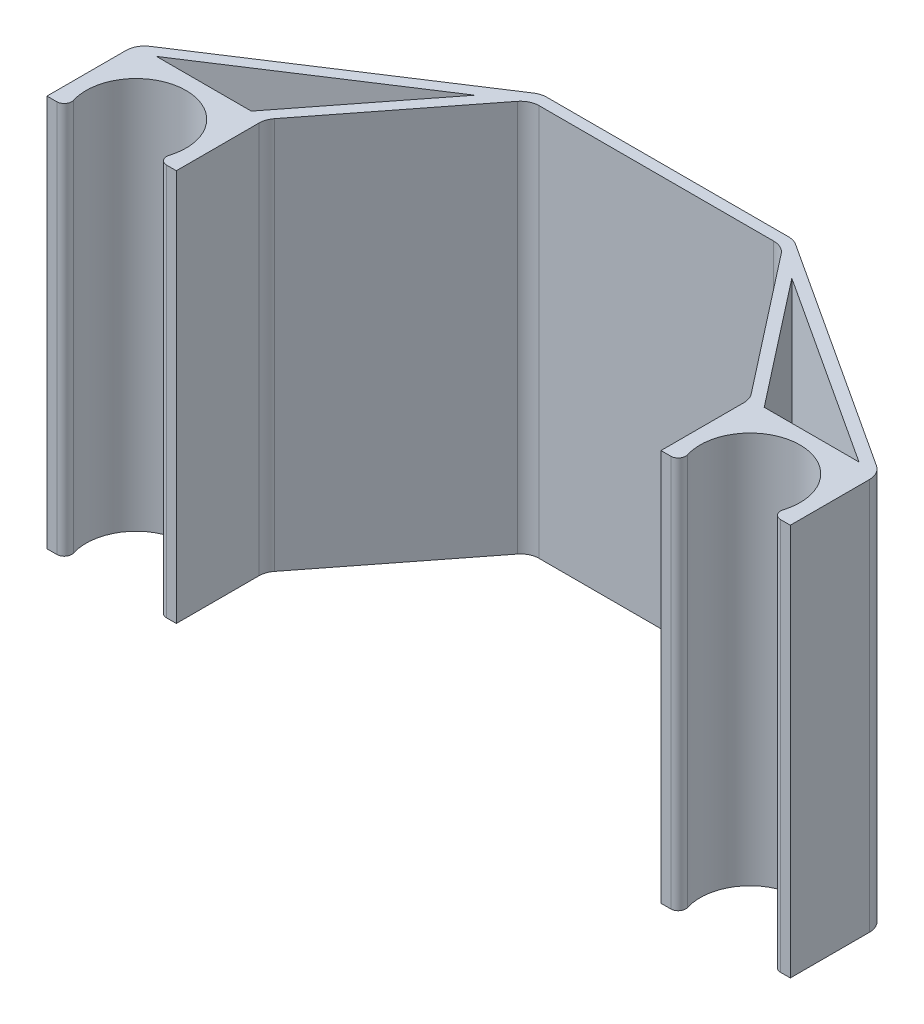
from build123d import *

# Parameters (mm, degrees)
BOSS_EXTRUDE1_DEPTH = 105.5
FILLET1_R           = 5


with BuildPart() as part:
    # Sketch1 → Boss-Extrude1 (new body)
    with BuildSketch(Plane(origin=(0, 0, 0), x_dir=(1, 0, 0), z_dir=(0, 1, 0))):
        with BuildLine():
            Line((0, 0), (-34, 0))
            Line((-34, 0), (-100, -43))
            Line((-100, -43), (-100, -66.97))
            Line((-100, -66.97), (-97.358644924, -66.97))
            ThreePointArc((-97.358644924, -66.97), (-95.748804634, -66.156766295), (-95.448140727, -64.378414239))
            ThreePointArc((-95.448140727, -64.378414239), (-82.6, -46.95), (-69.751859273, -64.378414239))
            ThreePointArc((-69.751859273, -64.378414239), (-69.451195366, -66.156766295), (-67.841355076, -66.97))
            Line((-67.841355076, -66.97), (-65.2, -66.97))
            Line((-65.2, -66.97), (-65.2, -43))
            Line((-65.2, -43), (-34, -3))
            Line((-34, -3), (0, -3))
            Line((0, -3), (0, 0))
        make_face()
        Polygon((-69.004681327, -43), (-94.504291462, -43), (-42.656655328, -9.220479488), align=None, mode=Mode.SUBTRACT)
    boss_extrude1 = extrude(amount=BOSS_EXTRUDE1_DEPTH)

    # Mirror1: Boss-Extrude1 across plane
    add(boss_extrude1.mirror(Plane(origin=(0, 105.5, 3), x_dir=(0, 0, 1), z_dir=(-1, 0, 0))))

    # Fillet1
    fillet1_edges = [part.edges().sort_by_distance(p)[0] for p in [
        (-34, 52.75, 3),
        (-65.2, 52.75, 43),
        (-100, 52.75, 43),
        (-34, 52.75, 0),
        (34, 52.75, 3),
        (65.2, 52.75, 43),
        (100, 52.75, 43),
        (34, 52.75, 0),
    ]]
    fillet(fillet1_edges, radius=FILLET1_R)


solid = part.part
